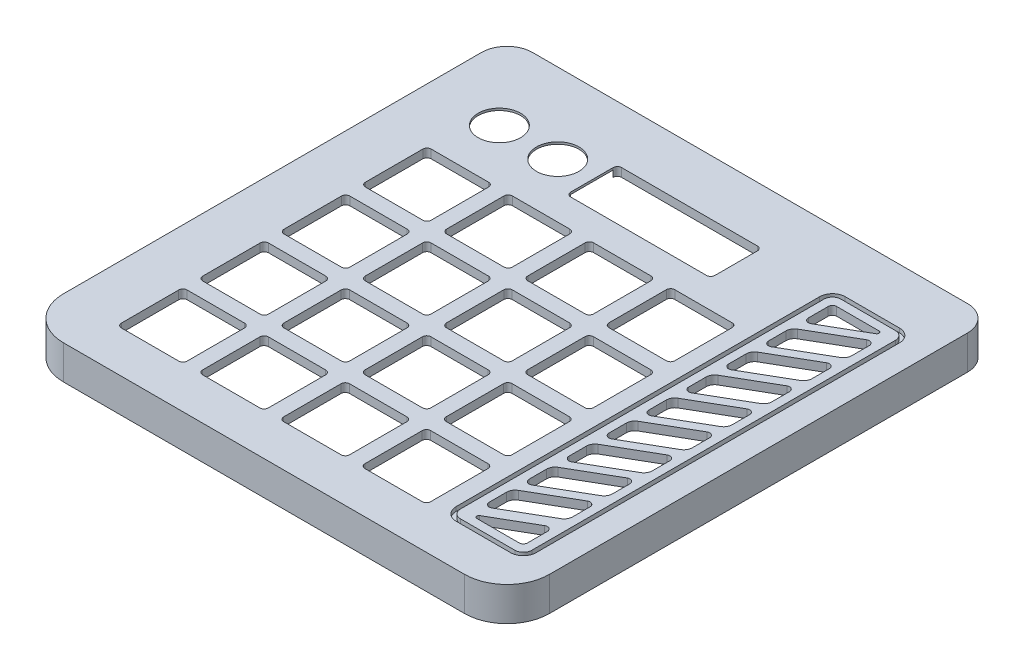
from build123d import *

# Parameters (mm, degrees)
BOSS_EXTRU_1_DEPTH      = 6
BOSS_EXTRU_2_DEPTH      = 2
ESQUISSE5_R             = 5
ENL_V_MAT_EXTRU_1_DEPTH = 33
ENL_V_MAT_EXTRU_2_DEPTH = 2
ENL_V_MAT_EXTRU_3_DEPTH = 1
ESQUISSE12_W            = 30
ESQUISSE12_H            = 20
ENL_V_MAT_EXTRU_7_DEPTH = 1.5
ENL_V_MAT_EXTRU_6_DEPTH = 10
BOSS_EXTRU_3_START      = -28.75
BOSS_EXTRU_3_DEPTH      = 79.5
ENL_V_START             = -28.75
ENL_V_MAT_EXTRU_8_DEPTH = 79.5
ESQUISSE15_W            = 1
ESQUISSE15_H            = 6
ENL_V_MAT_EXTRU_9_DEPTH = 5


with BuildPart() as part:
    # Esquisse2 → Boss.-Extru.1 (new body)
    with BuildSketch(Plane(origin=(0, 0, 0), x_dir=(1, 0, 0), z_dir=(0, 1, 0))):
        with BuildLine():
            Line((8, -2), (102.5, -2))
            ThreePointArc((102.5, -2), (109.571067812, 0.928932188), (112.5, 8))
            Line((112.5, 8), (112.5, 106.5))
            ThreePointArc((112.5, 106.5), (110.742640687, 110.742640687), (106.5, 112.5))
            Line((106.5, 112.5), (4, 112.5))
            ThreePointArc((4, 112.5), (-0.242640687, 110.742640687), (-2, 106.5))
            Line((-2, 106.5), (-2, 8))
            ThreePointArc((-2, 8), (0.928932188, 0.928932188), (8, -2))
        make_face()
        with BuildLine():
            Line((8, 0), (102.5, 0))
            ThreePointArc((102.5, 0), (108.156854249, 2.343145751), (110.5, 8))
            Line((110.5, 8), (110.5, 106.5))
            ThreePointArc((110.5, 106.5), (109.328427125, 109.328427125), (106.5, 110.5))
            Line((106.5, 110.5), (4, 110.5))
            ThreePointArc((4, 110.5), (1.171572875, 109.328427125), (0, 106.5))
            Line((0, 106.5), (0, 8))
            ThreePointArc((0, 8), (2.343145751, 2.343145751), (8, 0))
        make_face(mode=Mode.SUBTRACT)
    extrude(amount=BOSS_EXTRU_1_DEPTH)

    # Esquisse3 → Boss.-Extru.2 (add)
    with BuildSketch(Plane(origin=(0, 6, 0), x_dir=(1, 0, 0), z_dir=(0, 1, 0))):
        with BuildLine():
            Line((4, 112.5), (106.5, 112.5))
            ThreePointArc((106.5, 112.5), (110.742640687, 110.742640687), (112.5, 106.5))
            Line((112.5, 106.5), (112.5, 8))
            ThreePointArc((112.5, 8), (109.571067812, 0.928932188), (102.5, -2))
            Line((102.5, -2), (8, -2))
            ThreePointArc((8, -2), (0.928932188, 0.928932188), (-2, 8))
            Line((-2, 8), (-2, 106.5))
            ThreePointArc((-2, 106.5), (-0.242640687, 110.742640687), (4, 112.5))
        make_face()
    extrude(amount=BOSS_EXTRU_2_DEPTH)

    # Esquisse5 → Enlèv. mat.-Extru.1 (cut)
    with BuildSketch(Plane(origin=(0, 8, 0), x_dir=(1, 0, 0), z_dir=(0, 1, 0))):
        with BuildLine():
            ThreePointArc((37, 88.5), (37.292893219, 87.792893219), (38, 87.5))
            Line((38, 87.5), (70, 87.5))
            ThreePointArc((70, 87.5), (70.707106781, 87.792893219), (71, 88.5))
            Line((71, 88.5), (71, 98.5))
            ThreePointArc((71, 98.5), (70.707106781, 99.207106781), (70, 99.5))
            Line((70, 99.5), (38, 99.5))
            ThreePointArc((38, 99.5), (37.292893219, 99.207106781), (37, 98.5))
            Line((37, 98.5), (37, 88.5))
        make_face()
        with BuildLine():
            Line((25.3, 80.848985119), (11.8, 80.848985119))
            ThreePointArc((11.8, 80.848985119), (11.092893219, 80.5560919), (10.8, 79.848985119))
            Line((10.8, 79.848985119), (10.8, 66.348985119))
            ThreePointArc((10.8, 66.348985119), (11.092893219, 65.641878337), (11.8, 65.348985119))
            Line((11.8, 65.348985119), (25.3, 65.348985119))
            ThreePointArc((25.3, 65.348985119), (26.007106781, 65.641878337), (26.3, 66.348985119))
            Line((26.3, 66.348985119), (26.3, 79.848985119))
            ThreePointArc((26.3, 79.848985119), (26.007106781, 80.5560919), (25.3, 80.848985119))
        make_face()
        with BuildLine():
            ThreePointArc((30.9262, 80.848985119), (30.219093219, 80.5560919), (29.9262, 79.848985119))
            Line((29.9262, 79.848985119), (29.9262, 66.348985119))
            ThreePointArc((29.9262, 66.348985119), (30.219093219, 65.641878337), (30.9262, 65.348985119))
            Line((30.9262, 65.348985119), (44.4262, 65.348985119))
            ThreePointArc((44.4262, 65.348985119), (45.133306781, 65.641878337), (45.4262, 66.348985119))
            Line((45.4262, 66.348985119), (45.4262, 79.848985119))
            ThreePointArc((45.4262, 79.848985119), (45.133306781, 80.5560919), (44.4262, 80.848985119))
            Line((44.4262, 80.848985119), (30.9262, 80.848985119))
        make_face()
        with BuildLine():
            ThreePointArc((50.0524, 80.848985119), (49.345293219, 80.5560919), (49.0524, 79.848985119))
            Line((49.0524, 79.848985119), (49.0524, 66.348985119))
            ThreePointArc((49.0524, 66.348985119), (49.345293219, 65.641878337), (50.0524, 65.348985119))
            Line((50.0524, 65.348985119), (63.5524, 65.348985119))
            ThreePointArc((63.5524, 65.348985119), (64.259506781, 65.641878337), (64.5524, 66.348985119))
            Line((64.5524, 66.348985119), (64.5524, 79.848985119))
            ThreePointArc((64.5524, 79.848985119), (64.259506781, 80.5560919), (63.5524, 80.848985119))
            Line((63.5524, 80.848985119), (50.0524, 80.848985119))
        make_face()
        with BuildLine():
            ThreePointArc((69.1786, 80.848985119), (68.471493219, 80.5560919), (68.1786, 79.848985119))
            Line((68.1786, 79.848985119), (68.1786, 66.348985119))
            ThreePointArc((68.1786, 66.348985119), (68.471493219, 65.641878337), (69.1786, 65.348985119))
            Line((69.1786, 65.348985119), (82.6786, 65.348985119))
            ThreePointArc((82.6786, 65.348985119), (83.385706781, 65.641878337), (83.6786, 66.348985119))
            Line((83.6786, 66.348985119), (83.6786, 79.848985119))
            ThreePointArc((83.6786, 79.848985119), (83.385706781, 80.5560919), (82.6786, 80.848985119))
            Line((82.6786, 80.848985119), (69.1786, 80.848985119))
        make_face()
        with BuildLine():
            ThreePointArc((30.9262, 61.681485119), (30.219093219, 61.3885919), (29.9262, 60.681485119))
            Line((29.9262, 60.681485119), (29.9262, 47.181485119))
            ThreePointArc((29.9262, 47.181485119), (30.219093219, 46.474378337), (30.9262, 46.181485119))
            Line((30.9262, 46.181485119), (44.4262, 46.181485119))
            ThreePointArc((44.4262, 46.181485119), (45.133306781, 46.474378337), (45.4262, 47.181485119))
            Line((45.4262, 47.181485119), (45.4262, 60.681485119))
            ThreePointArc((45.4262, 60.681485119), (45.133306781, 61.3885919), (44.4262, 61.681485119))
            Line((44.4262, 61.681485119), (30.9262, 61.681485119))
        make_face()
        with BuildLine():
            ThreePointArc((50.0524, 61.681485119), (49.345293219, 61.3885919), (49.0524, 60.681485119))
            Line((49.0524, 60.681485119), (49.0524, 47.181485119))
            ThreePointArc((49.0524, 47.181485119), (49.345293219, 46.474378337), (50.0524, 46.181485119))
            Line((50.0524, 46.181485119), (63.5524, 46.181485119))
            ThreePointArc((63.5524, 46.181485119), (64.259506781, 46.474378337), (64.5524, 47.181485119))
            Line((64.5524, 47.181485119), (64.5524, 60.681485119))
            ThreePointArc((64.5524, 60.681485119), (64.259506781, 61.3885919), (63.5524, 61.681485119))
            Line((63.5524, 61.681485119), (50.0524, 61.681485119))
        make_face()
        with BuildLine():
            ThreePointArc((69.1786, 61.681485119), (68.471493219, 61.3885919), (68.1786, 60.681485119))
            Line((68.1786, 60.681485119), (68.1786, 47.181485119))
            ThreePointArc((68.1786, 47.181485119), (68.471493219, 46.474378337), (69.1786, 46.181485119))
            Line((69.1786, 46.181485119), (82.6786, 46.181485119))
            ThreePointArc((82.6786, 46.181485119), (83.385706781, 46.474378337), (83.6786, 47.181485119))
            Line((83.6786, 47.181485119), (83.6786, 60.681485119))
            ThreePointArc((83.6786, 60.681485119), (83.385706781, 61.3885919), (82.6786, 61.681485119))
            Line((82.6786, 61.681485119), (69.1786, 61.681485119))
        make_face()
        with BuildLine():
            ThreePointArc((30.9262, 42.513985119), (30.219093219, 42.2210919), (29.9262, 41.513985119))
            Line((29.9262, 41.513985119), (29.9262, 28.013985119))
            ThreePointArc((29.9262, 28.013985119), (30.219093219, 27.306878337), (30.9262, 27.013985119))
            Line((30.9262, 27.013985119), (44.4262, 27.013985119))
            ThreePointArc((44.4262, 27.013985119), (45.133306781, 27.306878337), (45.4262, 28.013985119))
            Line((45.4262, 28.013985119), (45.4262, 41.513985119))
            ThreePointArc((45.4262, 41.513985119), (45.133306781, 42.2210919), (44.4262, 42.513985119))
            Line((44.4262, 42.513985119), (30.9262, 42.513985119))
        make_face()
        with BuildLine():
            ThreePointArc((50.0524, 42.513985119), (49.345293219, 42.2210919), (49.0524, 41.513985119))
            Line((49.0524, 41.513985119), (49.0524, 28.013985119))
            ThreePointArc((49.0524, 28.013985119), (49.345293219, 27.306878337), (50.0524, 27.013985119))
            Line((50.0524, 27.013985119), (63.5524, 27.013985119))
            ThreePointArc((63.5524, 27.013985119), (64.259506781, 27.306878337), (64.5524, 28.013985119))
            Line((64.5524, 28.013985119), (64.5524, 41.513985119))
            ThreePointArc((64.5524, 41.513985119), (64.259506781, 42.2210919), (63.5524, 42.513985119))
            Line((63.5524, 42.513985119), (50.0524, 42.513985119))
        make_face()
        with BuildLine():
            ThreePointArc((69.1786, 42.513985119), (68.471493219, 42.2210919), (68.1786, 41.513985119))
            Line((68.1786, 41.513985119), (68.1786, 28.013985119))
            ThreePointArc((68.1786, 28.013985119), (68.471493219, 27.306878337), (69.1786, 27.013985119))
            Line((69.1786, 27.013985119), (82.6786, 27.013985119))
            ThreePointArc((82.6786, 27.013985119), (83.385706781, 27.306878337), (83.6786, 28.013985119))
            Line((83.6786, 28.013985119), (83.6786, 41.513985119))
            ThreePointArc((83.6786, 41.513985119), (83.385706781, 42.2210919), (82.6786, 42.513985119))
            Line((82.6786, 42.513985119), (69.1786, 42.513985119))
        make_face()
        with BuildLine():
            ThreePointArc((30.9262, 23.346485119), (30.219093219, 23.0535919), (29.9262, 22.346485119))
            Line((29.9262, 22.346485119), (29.9262, 8.846485119))
            ThreePointArc((29.9262, 8.846485119), (30.219093219, 8.139378337), (30.9262, 7.846485119))
            Line((30.9262, 7.846485119), (44.4262, 7.846485119))
            ThreePointArc((44.4262, 7.846485119), (45.133306781, 8.139378337), (45.4262, 8.846485119))
            Line((45.4262, 8.846485119), (45.4262, 22.346485119))
            ThreePointArc((45.4262, 22.346485119), (45.133306781, 23.0535919), (44.4262, 23.346485119))
            Line((44.4262, 23.346485119), (30.9262, 23.346485119))
        make_face()
        with BuildLine():
            ThreePointArc((50.0524, 23.346485119), (49.345293219, 23.0535919), (49.0524, 22.346485119))
            Line((49.0524, 22.346485119), (49.0524, 8.846485119))
            ThreePointArc((49.0524, 8.846485119), (49.345293219, 8.139378337), (50.0524, 7.846485119))
            Line((50.0524, 7.846485119), (63.5524, 7.846485119))
            ThreePointArc((63.5524, 7.846485119), (64.259506781, 8.139378337), (64.5524, 8.846485119))
            Line((64.5524, 8.846485119), (64.5524, 22.346485119))
            ThreePointArc((64.5524, 22.346485119), (64.259506781, 23.0535919), (63.5524, 23.346485119))
            Line((63.5524, 23.346485119), (50.0524, 23.346485119))
        make_face()
        with BuildLine():
            ThreePointArc((69.1786, 23.346485119), (68.471493219, 23.0535919), (68.1786, 22.346485119))
            Line((68.1786, 22.346485119), (68.1786, 8.846485119))
            ThreePointArc((68.1786, 8.846485119), (68.471493219, 8.139378337), (69.1786, 7.846485119))
            Line((69.1786, 7.846485119), (82.6786, 7.846485119))
            ThreePointArc((82.6786, 7.846485119), (83.385706781, 8.139378337), (83.6786, 8.846485119))
            Line((83.6786, 8.846485119), (83.6786, 22.346485119))
            ThreePointArc((83.6786, 22.346485119), (83.385706781, 23.0535919), (82.6786, 23.346485119))
            Line((82.6786, 23.346485119), (69.1786, 23.346485119))
        make_face()
        with BuildLine():
            ThreePointArc((11.8, 61.681485119), (11.092893219, 61.3885919), (10.8, 60.681485119))
            Line((10.8, 60.681485119), (10.8, 47.181485119))
            ThreePointArc((10.8, 47.181485119), (11.092893219, 46.474378337), (11.8, 46.181485119))
            Line((11.8, 46.181485119), (25.3, 46.181485119))
            ThreePointArc((25.3, 46.181485119), (26.007106781, 46.474378337), (26.3, 47.181485119))
            Line((26.3, 47.181485119), (26.3, 60.681485119))
            ThreePointArc((26.3, 60.681485119), (26.007106781, 61.3885919), (25.3, 61.681485119))
            Line((25.3, 61.681485119), (11.8, 61.681485119))
        make_face()
        with BuildLine():
            ThreePointArc((11.8, 42.513985119), (11.092893219, 42.2210919), (10.8, 41.513985119))
            Line((10.8, 41.513985119), (10.8, 28.013985119))
            ThreePointArc((10.8, 28.013985119), (11.092893219, 27.306878337), (11.8, 27.013985119))
            Line((11.8, 27.013985119), (25.3, 27.013985119))
            ThreePointArc((25.3, 27.013985119), (26.007106781, 27.306878337), (26.3, 28.013985119))
            Line((26.3, 28.013985119), (26.3, 41.513985119))
            ThreePointArc((26.3, 41.513985119), (26.007106781, 42.2210919), (25.3, 42.513985119))
            Line((25.3, 42.513985119), (11.8, 42.513985119))
        make_face()
        with BuildLine():
            ThreePointArc((11.8, 23.346485119), (11.092893219, 23.0535919), (10.8, 22.346485119))
            Line((10.8, 22.346485119), (10.8, 8.846485119))
            ThreePointArc((10.8, 8.846485119), (11.092893219, 8.139378337), (11.8, 7.846485119))
            Line((11.8, 7.846485119), (25.3, 7.846485119))
            ThreePointArc((25.3, 7.846485119), (26.007106781, 8.139378337), (26.3, 8.846485119))
            Line((26.3, 8.846485119), (26.3, 22.346485119))
            ThreePointArc((26.3, 22.346485119), (26.007106781, 23.0535919), (25.3, 23.346485119))
            Line((25.3, 23.346485119), (11.8, 23.346485119))
        make_face()
        with Locations((28.75, 93.7)):
            Circle(ESQUISSE5_R)
        with Locations((15, 93.7)):
            Circle(ESQUISSE5_R)
    extrude(amount=-ENL_V_MAT_EXTRU_1_DEPTH, mode=Mode.SUBTRACT)

    # Esquisse6 → Enlèv. mat.-Extru.2 (cut)
    with BuildSketch(Plane(origin=(0, 8, 0), x_dir=(1, 0, 0), z_dir=(0, 1, 0))):
        with BuildLine():
            Line((102, 93.233974596), (91.6786, 87.274911528))
            ThreePointArc((91.6786, 87.274911528), (90.946549192, 86.54286072), (90.6786, 85.54286072))
            Line((90.6786, 85.54286072), (90.6786, 81.429612066))
            ThreePointArc((90.6786, 81.429612066), (91.1786, 80.563586662), (92.1786, 80.563586662))
            Line((92.1786, 80.563586662), (102.5, 86.522649731))
            ThreePointArc((102.5, 86.522649731), (103.232050808, 87.254700538), (103.5, 88.254700538))
            Line((103.5, 88.254700538), (103.5, 92.367949192))
            ThreePointArc((103.5, 92.367949192), (103, 93.233974596), (102, 93.233974596))
        make_face()
        with BuildLine():
            ThreePointArc((91.6786, 96.5), (90.971493219, 96.207106781), (90.6786, 95.5))
            Line((90.6786, 95.5), (90.6786, 90.829612066))
            ThreePointArc((90.6786, 90.829612066), (91.1786, 89.963586662), (92.1786, 89.963586662))
            Line((92.1786, 89.963586662), (101.883974596, 95.566987298))
            ThreePointArc((101.883974596, 95.566987298), (102.116937509, 96.129409523), (101.633974596, 96.5))
            Line((101.633974596, 96.5), (91.6786, 96.5))
        make_face()
        with BuildLine():
            Line((92.544625404, 10.846485119), (102.5, 10.846485119))
            ThreePointArc((102.5, 10.846485119), (103.207106781, 11.139378337), (103.5, 11.846485119))
            Line((103.5, 11.846485119), (103.5, 16.516873052))
            ThreePointArc((103.5, 16.516873052), (103, 17.382898456), (102, 17.382898456))
            Line((102, 17.382898456), (92.294625404, 11.77949782))
            ThreePointArc((92.294625404, 11.77949782), (92.061662491, 11.217075596), (92.544625404, 10.846485119))
        make_face()
        with BuildLine():
            Line((90.6786, 76.14286072), (90.6786, 72.029612066))
            ThreePointArc((90.6786, 72.029612066), (91.1786, 71.163586662), (92.1786, 71.163586662))
            Line((92.1786, 71.163586662), (102.5, 77.122649731))
            ThreePointArc((102.5, 77.122649731), (103.232050808, 77.854700538), (103.5, 78.854700538))
            Line((103.5, 78.854700538), (103.5, 82.967949192))
            ThreePointArc((103.5, 82.967949192), (103, 83.833974596), (102, 83.833974596))
            Line((102, 83.833974596), (91.6786, 77.874911528))
            ThreePointArc((91.6786, 77.874911528), (90.946549192, 77.14286072), (90.6786, 76.14286072))
        make_face()
        with BuildLine():
            Line((90.6786, 66.74286072), (90.6786, 62.629612066))
            ThreePointArc((90.6786, 62.629612066), (91.1786, 61.763586662), (92.1786, 61.763586662))
            Line((92.1786, 61.763586662), (102.5, 67.722649731))
            ThreePointArc((102.5, 67.722649731), (103.232050808, 68.454700538), (103.5, 69.454700538))
            Line((103.5, 69.454700538), (103.5, 73.567949192))
            ThreePointArc((103.5, 73.567949192), (103, 74.433974596), (102, 74.433974596))
            Line((102, 74.433974596), (91.6786, 68.474911528))
            ThreePointArc((91.6786, 68.474911528), (90.946549192, 67.74286072), (90.6786, 66.74286072))
        make_face()
        with BuildLine():
            Line((90.6786, 57.34286072), (90.6786, 53.229612066))
            ThreePointArc((90.6786, 53.229612066), (91.1786, 52.363586662), (92.1786, 52.363586662))
            Line((92.1786, 52.363586662), (102.5, 58.322649731))
            ThreePointArc((102.5, 58.322649731), (103.232050808, 59.054700538), (103.5, 60.054700538))
            Line((103.5, 60.054700538), (103.5, 64.167949192))
            ThreePointArc((103.5, 64.167949192), (103, 65.033974596), (102, 65.033974596))
            Line((102, 65.033974596), (91.6786, 59.074911528))
            ThreePointArc((91.6786, 59.074911528), (90.946549192, 58.34286072), (90.6786, 57.34286072))
        make_face()
        with BuildLine():
            Line((90.6786, 47.94286072), (90.6786, 43.829612066))
            ThreePointArc((90.6786, 43.829612066), (91.1786, 42.963586662), (92.1786, 42.963586662))
            Line((92.1786, 42.963586662), (102.5, 48.922649731))
            ThreePointArc((102.5, 48.922649731), (103.232050808, 49.654700538), (103.5, 50.654700538))
            Line((103.5, 50.654700538), (103.5, 54.767949192))
            ThreePointArc((103.5, 54.767949192), (103, 55.633974596), (102, 55.633974596))
            Line((102, 55.633974596), (91.6786, 49.674911528))
            ThreePointArc((91.6786, 49.674911528), (90.946549192, 48.94286072), (90.6786, 47.94286072))
        make_face()
        with BuildLine():
            Line((90.6786, 38.54286072), (90.6786, 34.429612066))
            ThreePointArc((90.6786, 34.429612066), (91.1786, 33.563586662), (92.1786, 33.563586662))
            Line((92.1786, 33.563586662), (102.5, 39.522649731))
            ThreePointArc((102.5, 39.522649731), (103.232050808, 40.254700538), (103.5, 41.254700538))
            Line((103.5, 41.254700538), (103.5, 45.367949192))
            ThreePointArc((103.5, 45.367949192), (103, 46.233974596), (102, 46.233974596))
            Line((102, 46.233974596), (91.6786, 40.274911528))
            ThreePointArc((91.6786, 40.274911528), (90.946549192, 39.54286072), (90.6786, 38.54286072))
        make_face()
        with BuildLine():
            Line((90.6786, 29.14286072), (90.6786, 25.029612066))
            ThreePointArc((90.6786, 25.029612066), (91.1786, 24.163586662), (92.1786, 24.163586662))
            Line((92.1786, 24.163586662), (102.5, 30.122649731))
            ThreePointArc((102.5, 30.122649731), (103.232050808, 30.854700538), (103.5, 31.854700538))
            Line((103.5, 31.854700538), (103.5, 35.967949192))
            ThreePointArc((103.5, 35.967949192), (103, 36.833974596), (102, 36.833974596))
            Line((102, 36.833974596), (91.6786, 30.874911528))
            ThreePointArc((91.6786, 30.874911528), (90.946549192, 30.14286072), (90.6786, 29.14286072))
        make_face()
        with BuildLine():
            Line((90.6786, 19.74286072), (90.6786, 15.629612066))
            ThreePointArc((90.6786, 15.629612066), (91.1786, 14.763586662), (92.1786, 14.763586662))
            Line((92.1786, 14.763586662), (102.5, 20.722649731))
            ThreePointArc((102.5, 20.722649731), (103.232050808, 21.454700538), (103.5, 22.454700538))
            Line((103.5, 22.454700538), (103.5, 26.567949192))
            ThreePointArc((103.5, 26.567949192), (103, 27.433974596), (102, 27.433974596))
            Line((102, 27.433974596), (91.6786, 21.474911528))
            ThreePointArc((91.6786, 21.474911528), (90.946549192, 20.74286072), (90.6786, 19.74286072))
        make_face()
    extrude(amount=-ENL_V_MAT_EXTRU_2_DEPTH, mode=Mode.SUBTRACT)

    # Esquisse6<3> → Enlèv. mat.-Extru.3 (cut)
    with BuildSketch(Plane(origin=(0, 8, 0), x_dir=(1, 0, 0), z_dir=(0, 1, 0))):
        with BuildLine():
            Line((90.6786, 99.5), (103.5, 99.5))
            ThreePointArc((103.5, 99.5), (105.621320344, 98.621320344), (106.5, 96.5))
            Line((106.5, 96.5), (106.5, 10.846485119))
            ThreePointArc((106.5, 10.846485119), (105.621320344, 8.725164775), (103.5, 7.846485119))
            Line((103.5, 7.846485119), (90.6786, 7.846485119))
            ThreePointArc((90.6786, 7.846485119), (88.557279656, 8.725164775), (87.6786, 10.846485119))
            Line((87.6786, 10.846485119), (87.6786, 96.5))
            ThreePointArc((87.6786, 96.5), (88.557279656, 98.621320344), (90.6786, 99.5))
        make_face()
        with BuildLine():
            Line((88.6786, 96.5), (88.6786, 10.846485119))
            ThreePointArc((88.6786, 10.846485119), (89.264386438, 9.432271556), (90.6786, 8.846485119))
            Line((90.6786, 8.846485119), (103.5, 8.846485119))
            ThreePointArc((103.5, 8.846485119), (104.914213562, 9.432271556), (105.5, 10.846485119))
            Line((105.5, 10.846485119), (105.5, 96.5))
            ThreePointArc((105.5, 96.5), (104.914213562, 97.914213562), (103.5, 98.5))
            Line((103.5, 98.5), (90.6786, 98.5))
            ThreePointArc((90.6786, 98.5), (89.264386438, 97.914213562), (88.6786, 96.5))
        make_face(mode=Mode.SUBTRACT)
    extrude(amount=-ENL_V_MAT_EXTRU_3_DEPTH, mode=Mode.SUBTRACT)

    # Esquisse12 → Enlèv. mat.-Extru.7 (cut)
    with BuildSketch(Plane.XZ.offset(-6)):
        with Locations((22, -93.7)):
            Rectangle(ESQUISSE12_W, ESQUISSE12_H)
    extrude(amount=-ENL_V_MAT_EXTRU_7_DEPTH, mode=Mode.SUBTRACT)

    # Esquisse11 → Enlèv. mat.-Extru.6 (cut)
    with BuildSketch(Plane(origin=(0, 0, -112.5), x_dir=(-1, 0, 0), z_dir=(0, 0, -1))):
        with BuildLine():
            Line((-99.75, 0), (-83.75, 0))
            Line((-83.75, 0), (-83.75, 4))
            Line((-83.75, 4), (-83.75, 6))
            Line((-83.75, 6), (-85.75, 6))
            Line((-85.75, 6), (-97.75, 6))
            ThreePointArc((-97.75, 6), (-99.164213562, 5.414213562), (-99.75, 4))
            Line((-99.75, 4), (-99.75, 0))
        make_face()
    extrude(amount=-ENL_V_MAT_EXTRU_6_DEPTH, mode=Mode.SUBTRACT)

    # Esquisse13 → Boss.-Extru.3 (add)
    with BuildSketch(Plane(origin=(112.5, 0, 0), x_dir=(0, 0, -1), z_dir=(1, 0, 0)).offset(BOSS_EXTRU_3_START)):
        Polygon((110.5, 6), (109.442038116, 0), (111.442038116, 0), (112.5, 6), align=None)
    extrude(amount=-BOSS_EXTRU_3_DEPTH)

    # Esquisse14 → Enlèv. mat.-Extru.8 (cut)
    with BuildSketch(Plane(origin=(112.5, 0, 0), x_dir=(0, 0, -1), z_dir=(1, 0, 0)).offset(ENL_V_START)):
        Polygon((111.442038116, 0), (112.5, 0), (112.5, 6), align=None)
    extrude(amount=-ENL_V_MAT_EXTRU_8_DEPTH, mode=Mode.SUBTRACT)

    # Esquisse15 → Enlèv. mat.-Extru.9 (cut)
    with BuildSketch(Plane(origin=(0, 0, -112.5), x_dir=(-1, 0, 0), z_dir=(0, 0, -1))):
        with Locations((-57.75, 3)):
            Rectangle(ESQUISSE15_W, ESQUISSE15_H)
        with Locations((-31.25, 3)):
            Rectangle(ESQUISSE15_W, ESQUISSE15_H)
        with Locations((-4.75, 3)):
            Rectangle(ESQUISSE15_W, ESQUISSE15_H)
    extrude(amount=-ENL_V_MAT_EXTRU_9_DEPTH, mode=Mode.SUBTRACT)


solid = part.part
